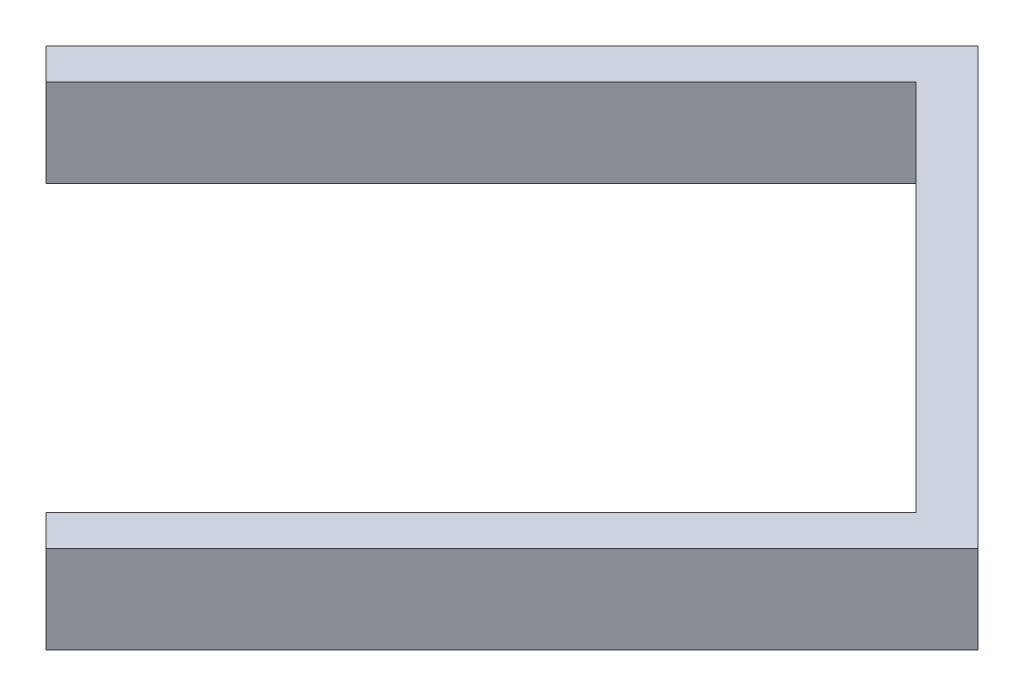
from build123d import *

# Parameters (mm, degrees)
BOSS_EXTRUDE2_DEPTH = 50.8
SKETCH3_R           = 6.35
CUT_EXTRUDE1_DEPTH  = 50.8


with BuildPart() as part:
    # Sketch2 → Boss-Extrude2 (new body)
    with BuildSketch(Plane(origin=(0, 0, 0), x_dir=(1, 0, 0), z_dir=(0, 1, 0))):
        Polygon((11.303891564, 227.410947331), (-240.143279826, -24.036224059), (-258.103792068, -6.075711817), (11.303891564, 263.331971815), (262.751062954, 11.884800425), (-6.656620678, -257.522883207), (-24.61713292, -239.562370965), (226.83003847, 11.884800425), align=None)
    extrude(amount=BOSS_EXTRUDE2_DEPTH)

    # Sketch3 → Cut-Extrude1 (cut)
    with BuildSketch(Plane(origin=(137.31793169, 0, -137.31793169), x_dir=(-0.7071067811865475, 0, -0.7071067811865477), z_dir=(0.7071067811865477, 0, -0.7071067811865475))):
        with Locations((0, 25.4)):
            Circle(SKETCH3_R)
    extrude(amount=-CUT_EXTRUDE1_DEPTH, mode=Mode.SUBTRACT)


solid = part.part
